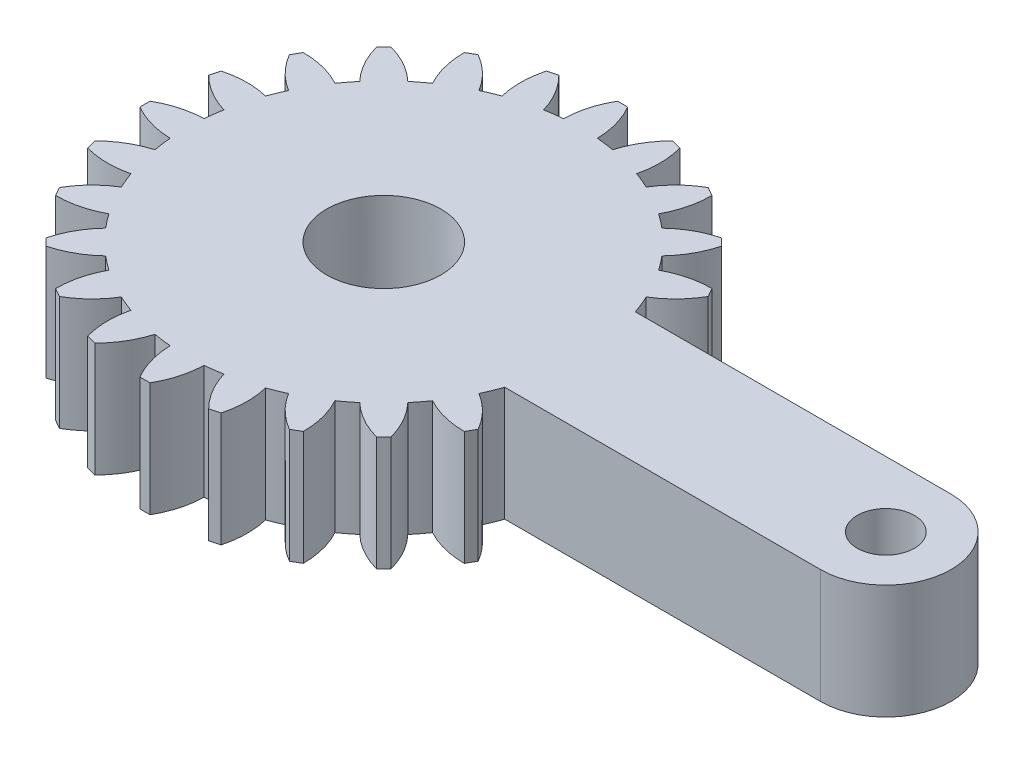
from build123d import *

# Parameters (mm, degrees)
SKETCH1_R           = 3.5
SKETCH1_R_2         = 1.75
BOSS_EXTRUDE1_DEPTH = 7
SKETCH2_R           = 3.5
SKETCH2_R_2         = 1.75
BOSS_EXTRUDE2_DEPTH = 2


with BuildPart() as part:
    # Sketch1 → Boss-Extrude1 (new body)
    with BuildSketch(Plane(origin=(0, 0, 0), x_dir=(1, 0, 0), z_dir=(0, 1, 0))):
        with BuildLine():
            ThreePointArc((1.04, 12.04518576), (0.838273314, 13.383704325), (0.31, 14.63))
            Line((0.31, 14.63), (-0.31, 14.63))
            ThreePointArc((-0.31, 14.63), (-0.838273314, 13.383704325), (-1.04, 12.04518576))
            ThreePointArc((-1.04, 12.04518576), (-1.578061664, 11.986568374), (-2.112960617, 11.903927815))
            ThreePointArc((-2.112960617, 11.903927815), (-2.65424773, 13.144626757), (-3.487085624, 14.211728743))
            Line((-3.487085624, 14.211728743), (-4.085959636, 14.051260935))
            ThreePointArc((-4.085959636, 14.051260935), (-4.273667417, 12.71070456), (-4.122086336, 11.365584201))
            ThreePointArc((-4.122086336, 11.365584201), (-4.626642697, 11.169703548), (-5.12192646, 10.951436862))
            ThreePointArc((-5.12192646, 10.951436862), (-5.965886177, 12.009764599), (-7.046532125, 12.824951657))
            Line((-7.046532125, 12.824951657), (-7.583467875, 12.514951657))
            ThreePointArc((-7.583467875, 12.514951657), (-7.417818147, 11.171491285), (-6.9232593, 9.911436862))
            ThreePointArc((-6.9232593, 9.911436862), (-7.359925677, 9.591641884), (-7.781841479, 9.252623584))
            ThreePointArc((-7.781841479, 9.252623584), (-8.870959341, 10.05645683), (-10.125769107, 10.564175311))
            Line((-10.125769107, 10.564175311), (-10.564175311, 10.125769107))
            ThreePointArc((-10.564175311, 10.125769107), (-10.05645683, 8.870959341), (-9.252623584, 7.781841479))
            ThreePointArc((-9.252623584, 7.781841479), (-9.591641884, 7.359925677), (-9.911436862, 6.9232593))
            ThreePointArc((-9.911436862, 6.9232593), (-11.171491285, 7.417818147), (-12.514951657, 7.583467875))
            Line((-12.514951657, 7.583467875), (-12.824951657, 7.046532125))
            ThreePointArc((-12.824951657, 7.046532125), (-12.009764599, 5.965886177), (-10.951436862, 5.12192646))
            ThreePointArc((-10.951436862, 5.12192646), (-11.169703548, 4.626642697), (-11.365584201, 4.122086336))
            ThreePointArc((-11.365584201, 4.122086336), (-12.71070456, 4.273667417), (-14.051260935, 4.085959636))
            Line((-14.051260935, 4.085959636), (-14.211728743, 3.487085624))
            ThreePointArc((-14.211728743, 3.487085624), (-13.144626757, 2.65424773), (-11.903927815, 2.112960617))
            ThreePointArc((-11.903927815, 2.112960617), (-11.986568374, 1.578061664), (-12.04518576, 1.04))
            ThreePointArc((-12.04518576, 1.04), (-13.383704325, 0.838273314), (-14.63, 0.31))
            Line((-14.63, 0.31), (-14.63, -0.31))
            ThreePointArc((-14.63, -0.31), (-13.383704325, -0.838273314), (-12.04518576, -1.04))
            ThreePointArc((-12.04518576, -1.04), (-11.986568374, -1.578061664), (-11.903927815, -2.112960617))
            ThreePointArc((-11.903927815, -2.112960617), (-13.144626757, -2.65424773), (-14.211728743, -3.487085624))
            Line((-14.211728743, -3.487085624), (-14.051260935, -4.085959636))
            ThreePointArc((-14.051260935, -4.085959636), (-12.71070456, -4.273667417), (-11.365584201, -4.122086336))
            ThreePointArc((-11.365584201, -4.122086336), (-11.169703548, -4.626642697), (-10.951436862, -5.12192646))
            ThreePointArc((-10.951436862, -5.12192646), (-12.009764599, -5.965886177), (-12.824951657, -7.046532125))
            Line((-12.824951657, -7.046532125), (-12.514951657, -7.583467875))
            ThreePointArc((-12.514951657, -7.583467875), (-11.171491285, -7.417818147), (-9.911436862, -6.9232593))
            ThreePointArc((-9.911436862, -6.9232593), (-9.591641884, -7.359925677), (-9.252623584, -7.781841479))
            ThreePointArc((-9.252623584, -7.781841479), (-10.05645683, -8.870959341), (-10.564175311, -10.125769107))
            Line((-10.564175311, -10.125769107), (-10.125769107, -10.564175311))
            ThreePointArc((-10.125769107, -10.564175311), (-8.870959341, -10.05645683), (-7.781841479, -9.252623584))
            ThreePointArc((-7.781841479, -9.252623584), (-7.359925677, -9.591641884), (-6.9232593, -9.911436862))
            ThreePointArc((-6.9232593, -9.911436862), (-7.417818147, -11.171491285), (-7.583467875, -12.514951657))
            Line((-7.583467875, -12.514951657), (-7.046532125, -12.824951657))
            ThreePointArc((-7.046532125, -12.824951657), (-5.965886177, -12.009764599), (-5.12192646, -10.951436862))
            ThreePointArc((-5.12192646, -10.951436862), (-4.626642697, -11.169703548), (-4.122086336, -11.365584201))
            ThreePointArc((-4.122086336, -11.365584201), (-4.273667417, -12.71070456), (-4.085959636, -14.051260935))
            Line((-4.085959636, -14.051260935), (-3.487085624, -14.211728743))
            ThreePointArc((-3.487085624, -14.211728743), (-2.65424773, -13.144626757), (-2.112960617, -11.903927815))
            ThreePointArc((-2.112960617, -11.903927815), (-1.578061664, -11.986568374), (-1.04, -12.04518576))
            ThreePointArc((-1.04, -12.04518576), (-0.838273314, -13.383704325), (-0.31, -14.63))
            Line((-0.31, -14.63), (0.31, -14.63))
            ThreePointArc((0.31, -14.63), (0.838273314, -13.383704325), (1.04, -12.04518576))
            ThreePointArc((1.04, -12.04518576), (1.578061664, -11.986568374), (2.112960617, -11.903927815))
            ThreePointArc((2.112960617, -11.903927815), (2.65424773, -13.144626757), (3.487085624, -14.211728743))
            Line((3.487085624, -14.211728743), (4.085959636, -14.051260935))
            ThreePointArc((4.085959636, -14.051260935), (4.273667417, -12.71070456), (4.122086336, -11.365584201))
            ThreePointArc((4.122086336, -11.365584201), (4.626642697, -11.169703548), (5.12192646, -10.951436862))
            ThreePointArc((5.12192646, -10.951436862), (5.965886177, -12.009764599), (7.046532125, -12.824951657))
            Line((7.046532125, -12.824951657), (7.583467875, -12.514951657))
            ThreePointArc((7.583467875, -12.514951657), (7.417818147, -11.171491285), (6.9232593, -9.911436862))
            ThreePointArc((6.9232593, -9.911436862), (7.359925677, -9.591641884), (7.781841479, -9.252623584))
            ThreePointArc((7.781841479, -9.252623584), (8.870959341, -10.05645683), (10.125769107, -10.564175311))
            Line((10.125769107, -10.564175311), (10.564175311, -10.125769107))
            ThreePointArc((10.564175311, -10.125769107), (10.05645683, -8.870959341), (9.252623584, -7.781841479))
            ThreePointArc((9.252623584, -7.781841479), (9.591641884, -7.359925677), (9.911436862, -6.9232593))
            ThreePointArc((9.911436862, -6.9232593), (11.171491285, -7.417818147), (12.514951657, -7.583467875))
            Line((12.514951657, -7.583467875), (12.824951657, -7.046532125))
            ThreePointArc((12.824951657, -7.046532125), (12.009764599, -5.965886177), (10.951436862, -5.12192646))
            ThreePointArc((10.951436862, -5.12192646), (11.194344337, -4.566700654), (11.409123542, -4))
            Line((11.409123542, -4), (30.75, -4))
            ThreePointArc((30.75, -4), (34.75, 0), (30.75, 4))
            Line((30.75, 4), (11.409123542, 4))
            ThreePointArc((11.409123542, 4), (11.194344337, 4.566700654), (10.951436862, 5.12192646))
            ThreePointArc((10.951436862, 5.12192646), (12.009764599, 5.965886177), (12.824951657, 7.046532125))
            Line((12.824951657, 7.046532125), (12.514951657, 7.583467875))
            ThreePointArc((12.514951657, 7.583467875), (11.171491285, 7.417818147), (9.911436862, 6.9232593))
            ThreePointArc((9.911436862, 6.9232593), (9.591641884, 7.359925677), (9.252623584, 7.781841479))
            ThreePointArc((9.252623584, 7.781841479), (10.05645683, 8.870959341), (10.564175311, 10.125769107))
            Line((10.564175311, 10.125769107), (10.125769107, 10.564175311))
            ThreePointArc((10.125769107, 10.564175311), (8.870959341, 10.05645683), (7.781841479, 9.252623584))
            ThreePointArc((7.781841479, 9.252623584), (7.359925677, 9.591641884), (6.9232593, 9.911436862))
            ThreePointArc((6.9232593, 9.911436862), (7.417818147, 11.171491285), (7.583467875, 12.514951657))
            Line((7.583467875, 12.514951657), (7.046532125, 12.824951657))
            ThreePointArc((7.046532125, 12.824951657), (5.965886177, 12.009764599), (5.12192646, 10.951436862))
            ThreePointArc((5.12192646, 10.951436862), (4.626642697, 11.169703548), (4.122086336, 11.365584201))
            ThreePointArc((4.122086336, 11.365584201), (4.273667417, 12.71070456), (4.085959636, 14.051260935))
            Line((4.085959636, 14.051260935), (3.487085624, 14.211728743))
            ThreePointArc((3.487085624, 14.211728743), (2.65424773, 13.144626757), (2.112960617, 11.903927815))
            ThreePointArc((2.112960617, 11.903927815), (1.578061664, 11.986568374), (1.04, 12.04518576))
        make_face()
        with Locations(Location((0, 0, 0), (0, 0, 270))):
            Circle(SKETCH1_R, mode=Mode.SUBTRACT)
        with Locations(Location((30.75, 0, 0), (0, 0, 270))):
            Circle(SKETCH1_R_2, mode=Mode.SUBTRACT)
    extrude(amount=BOSS_EXTRUDE1_DEPTH)

    # Sketch2 → Boss-Extrude2 (add)
    with BuildSketch(Plane.XZ):
        with Locations(Location((0, 0, 0), (0, 0, 270))):
            Circle(SKETCH2_R)
        with Locations(Location((0, 0, 0), (0, 0, 270))):
            Circle(SKETCH2_R_2, mode=Mode.SUBTRACT)
    extrude(amount=-BOSS_EXTRUDE2_DEPTH)


solid = part.part
